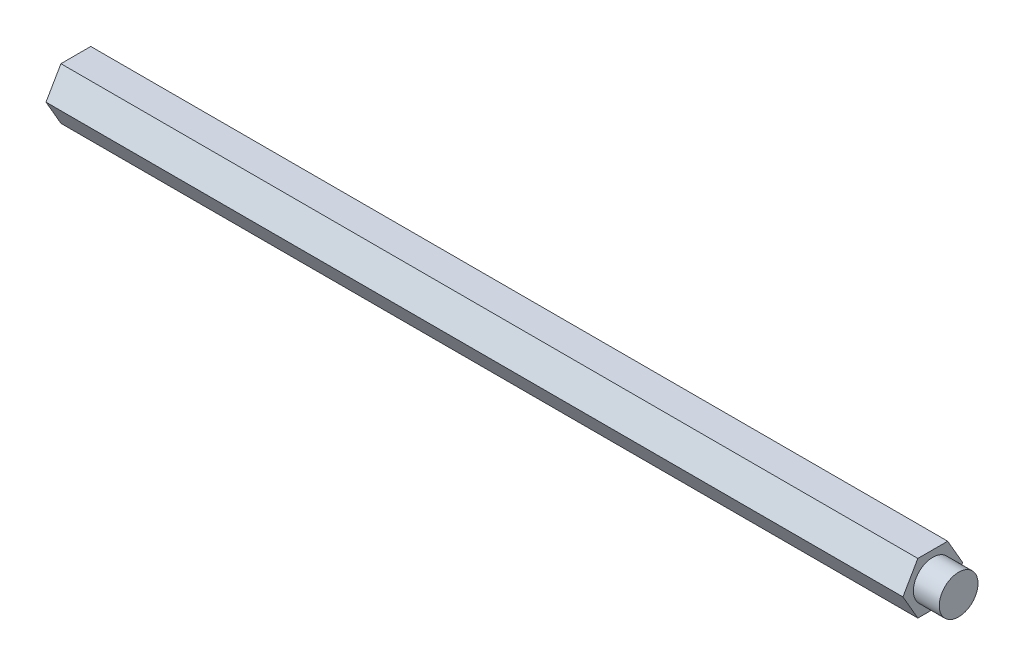
from build123d import *

# Parameters (mm, degrees)
SALIENTE_EXTRUIR1_DEPTH = 210.53
CROQUIS2_R              = 4.7625
SALIENTE_EXTRUIR2_DEPTH = 6.35


with BuildPart() as part:
    # Croquis1 → Saliente-Extruir1 (new body)
    with BuildSketch(Plane(origin=(0, 0, 0), x_dir=(0, 0, -1), z_dir=(1, 0, 0))):
        Polygon((7.332348419, 0), (3.666174209, 6.35), (-3.666174209, 6.35), (-7.332348419, 0), (-3.666174209, -6.35), (3.666174209, -6.35), align=None)
    extrude(amount=SALIENTE_EXTRUIR1_DEPTH)

    # Croquis2 → Saliente-Extruir2 (add)
    with BuildSketch(Plane(origin=(210.53, 0, 0), x_dir=(0, 0, -1), z_dir=(1, 0, 0))):
        Circle(CROQUIS2_R)
    extrude(amount=SALIENTE_EXTRUIR2_DEPTH)


solid = part.part
